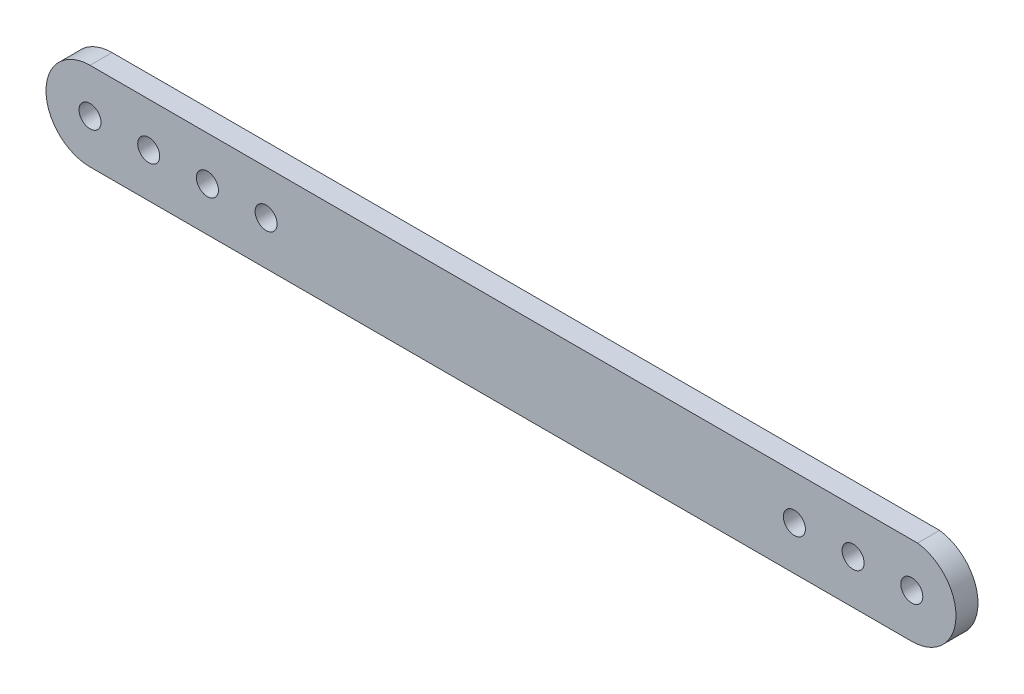
from build123d import *

# Parameters (mm, degrees)
SKETCH1_R           = 2.38125
BOSS_EXTRUDE1_DEPTH = 4.7625


with BuildPart() as part:
    # Sketch1 → Boss-Extrude1 (new body)
    with BuildSketch(Plane.XY):
        with BuildLine():
            Line((0, 9.525), (179.055725947, 9.525))
            ThreePointArc((179.055725947, 9.525), (187.345605876, -0.58786798), (177.799932549, -9.525))
            Line((177.799932549, -9.525), (0, -9.525))
            ThreePointArc((0, -9.525), (-9.525, 0), (0, 9.525))
        make_face()
        with Locations(Location((0, 0, 0), (0, 0, 180))):
            Circle(SKETCH1_R, mode=Mode.SUBTRACT)
        with Locations(Location((12.7, 0, 0), (0, 0, 180))):
            Circle(SKETCH1_R, mode=Mode.SUBTRACT)
        with Locations(Location((25.4, 0, 0), (0, 0, 180))):
            Circle(SKETCH1_R, mode=Mode.SUBTRACT)
        with Locations(Location((38.1, 0, 0), (0, 0, 180))):
            Circle(SKETCH1_R, mode=Mode.SUBTRACT)
        with Locations(Location((177.799932549, 0.041391524, 0), (0, 0, 180))):
            Circle(SKETCH1_R, mode=Mode.SUBTRACT)
        with Locations(Location((165.1, 2.22e-07, 0), (0, 0, 180))):
            Circle(SKETCH1_R, mode=Mode.SUBTRACT)
        with Locations(Location((152.4, 2.7e-08, 0), (0, 0, 180))):
            Circle(SKETCH1_R, mode=Mode.SUBTRACT)
    extrude(amount=BOSS_EXTRUDE1_DEPTH)


solid = part.part
